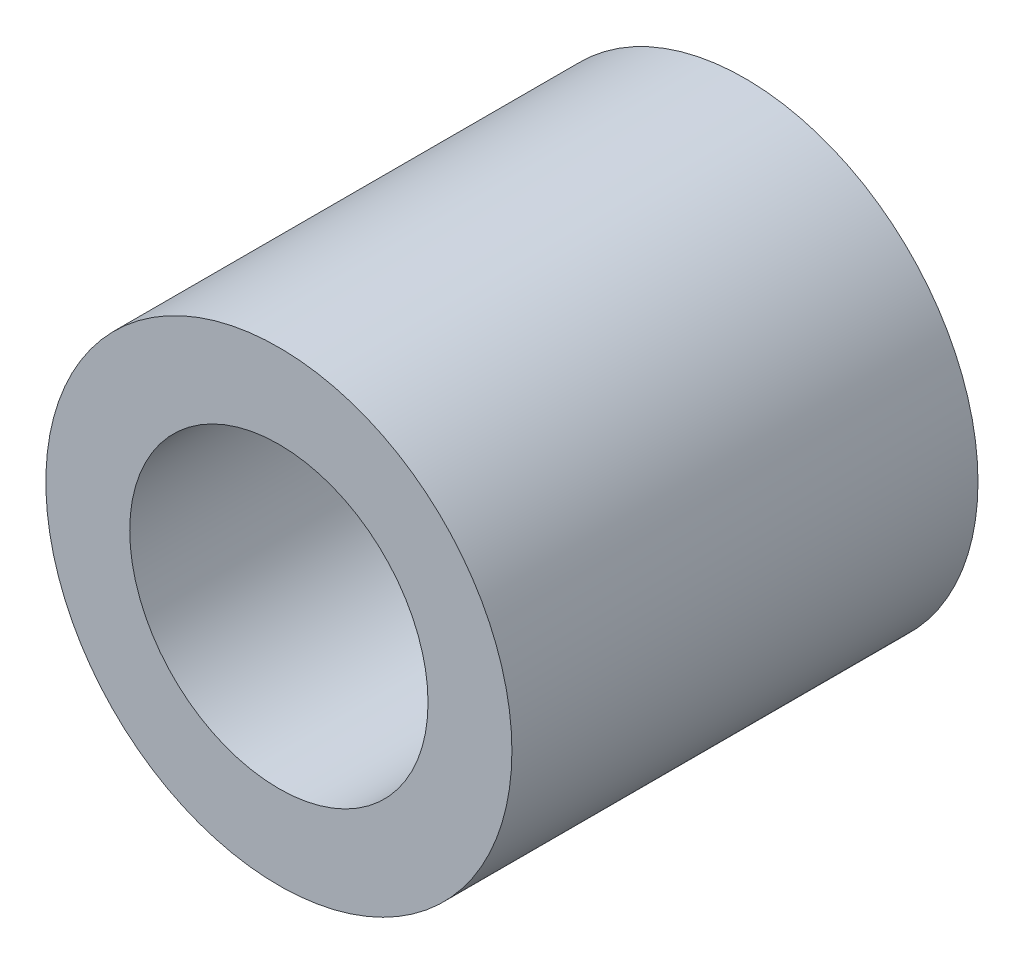
from build123d import *

# Parameters (mm, degrees)
SKETCH1_R           = 2.5
SKETCH1_R_2         = 1.6
BOSS_EXTRUDE1_DEPTH = 5


with BuildPart() as part:
    # Sketch1 → Boss-Extrude1 (new body)
    with BuildSketch(Plane.XY):
        Circle(SKETCH1_R)
        Circle(SKETCH1_R_2, mode=Mode.SUBTRACT)
    extrude(amount=BOSS_EXTRUDE1_DEPTH)


solid = part.part
